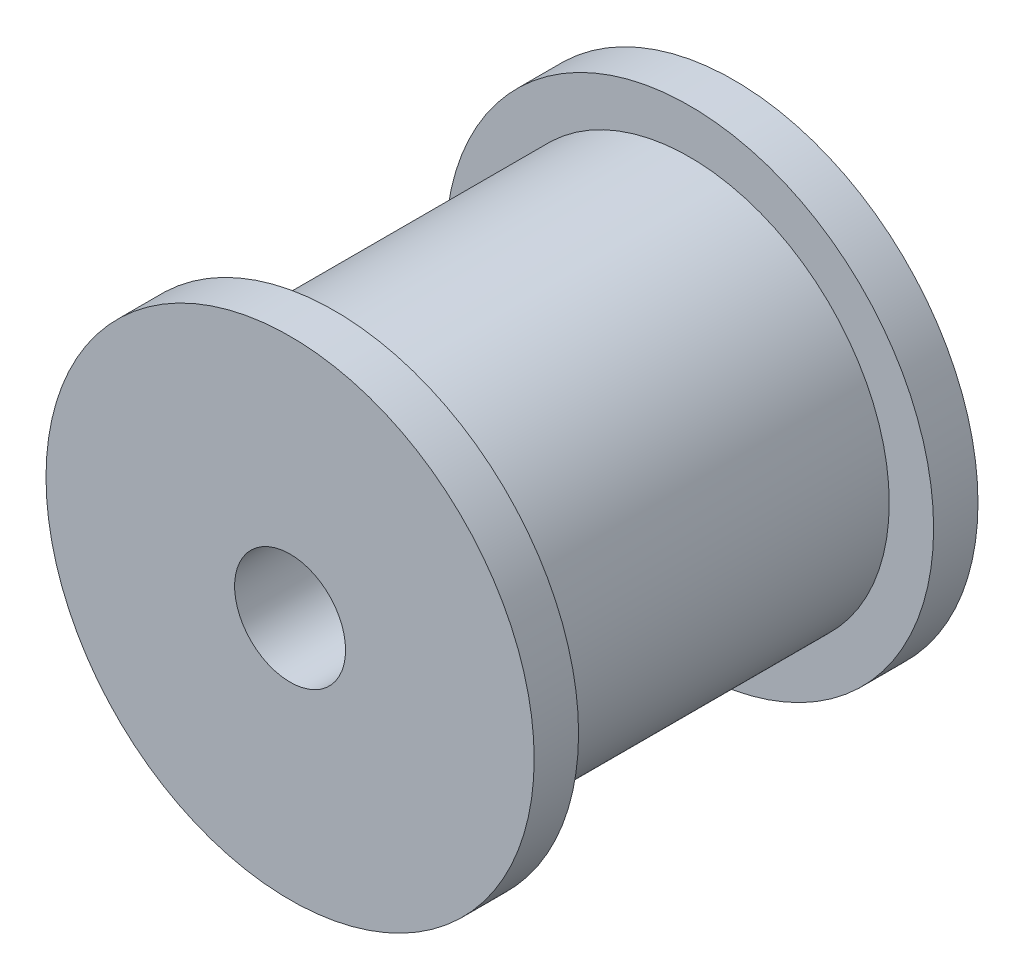
from build123d import *

# Parameters (mm, degrees)
SKETCH_1_R          = 11
EXTRUDE_1_DEPTH     = 2
SKETCH_2_R          = 9
EXTRUDE_2_DEPTH     = 16
SKETCH_3_R          = 11
EXTRUDE_3_DEPTH     = 2
SKETCH_4_R          = 2.5
CUT_EXTRUDE_1_DEPTH = 26.337718919


with BuildPart() as part:
    # Эскиз1 → Бобышка-Вытянуть1 (new body)
    with BuildSketch(Plane.XY):
        Circle(SKETCH_1_R)
    extrude(amount=EXTRUDE_1_DEPTH)

    # Эскиз2 → Бобышка-Вытянуть2 (add)
    with BuildSketch(Plane.XY.offset(2)):
        Circle(SKETCH_2_R)
    extrude(amount=EXTRUDE_2_DEPTH)

    # Эскиз3 → Бобышка-Вытянуть3 (add)
    with BuildSketch(Plane.XY.offset(18)):
        Circle(SKETCH_3_R)
    extrude(amount=EXTRUDE_3_DEPTH)

    # Эскиз4 → Вырез-Вытянуть1 (cut, through all)
    with BuildSketch(Plane.XY.offset(20)):
        Circle(SKETCH_4_R)
    extrude(amount=-CUT_EXTRUDE_1_DEPTH, mode=Mode.SUBTRACT)


solid = part.part
